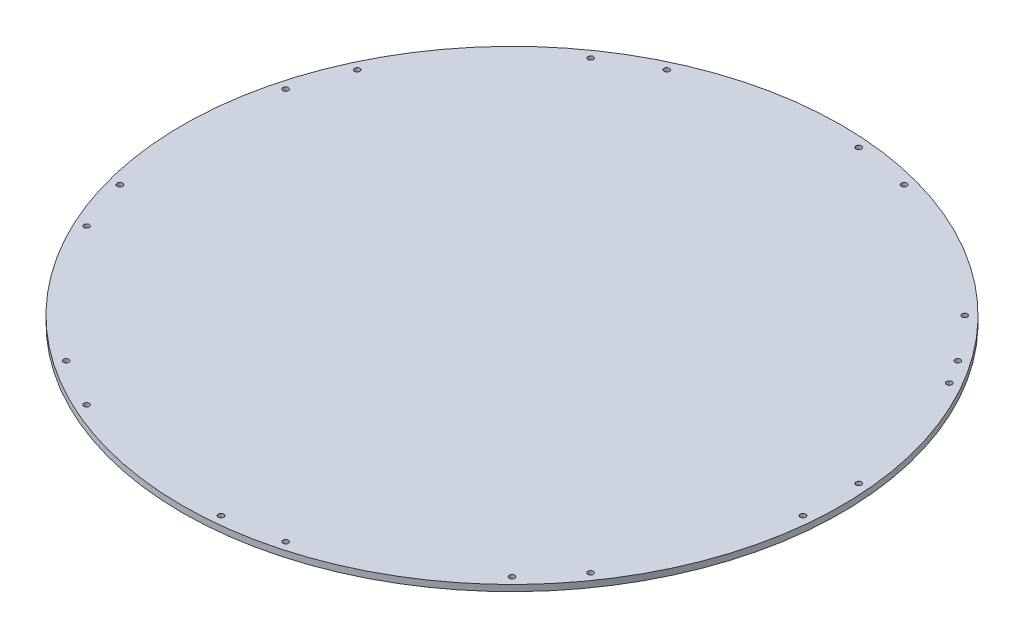
from build123d import *

# Parameters (mm, degrees)
SKETCH1_R           = 309.88
BOSS_EXTRUDE1_DEPTH = 5.842
SKETCH2_R           = 2.5527
CUT_EXTRUDE1_DEPTH  = 439.275435958
CIRPATTERN1_COUNT   = 9
SKETCH3_R           = 2.5527
HOLE_WIRE_DEPTH     = 439.275435958


with BuildPart() as part:
    # Sketch1 → Boss-Extrude1 (new body)
    with BuildSketch(Plane(origin=(0, 0, 0), x_dir=(1, 0, 0), z_dir=(0, 1, 0))):
        Circle(SKETCH1_R)
    extrude(amount=BOSS_EXTRUDE1_DEPTH)

    # Sketch2 → Cut-Extrude1 (cut, through all)
    with BuildSketch(Plane(origin=(0, 5.842, 0), x_dir=(1, 0, 0), z_dir=(0, 1, 0))):
        with Locations((-290.734014455, 77.901944385)):
            Circle(SKETCH2_R)
        with Locations((-290.734014455, -77.901944385)):
            Circle(SKETCH2_R)
    cut_extrude1 = extrude(amount=-CUT_EXTRUDE1_DEPTH, mode=Mode.SUBTRACT)

    # CirPattern1: Cut-Extrude1 ×9 about axis
    cirpattern1_axis = Axis((0, 6.6675, 0), (0, -1, 0))
    for i in range(1, CIRPATTERN1_COUNT):
        add(cut_extrude1.rotate(cirpattern1_axis, i * 360 / CIRPATTERN1_COUNT), mode=Mode.SUBTRACT)

    # Sketch3 → Hole_Wire (cut, through all)
    with BuildSketch(Plane(origin=(0, 5.842, 0), x_dir=(1, 0, 0), z_dir=(0, 1, 0))):
        with Locations((260.664986285, 150.495)):
            Circle(SKETCH3_R)
    extrude(amount=-HOLE_WIRE_DEPTH, mode=Mode.SUBTRACT)


solid = part.part
